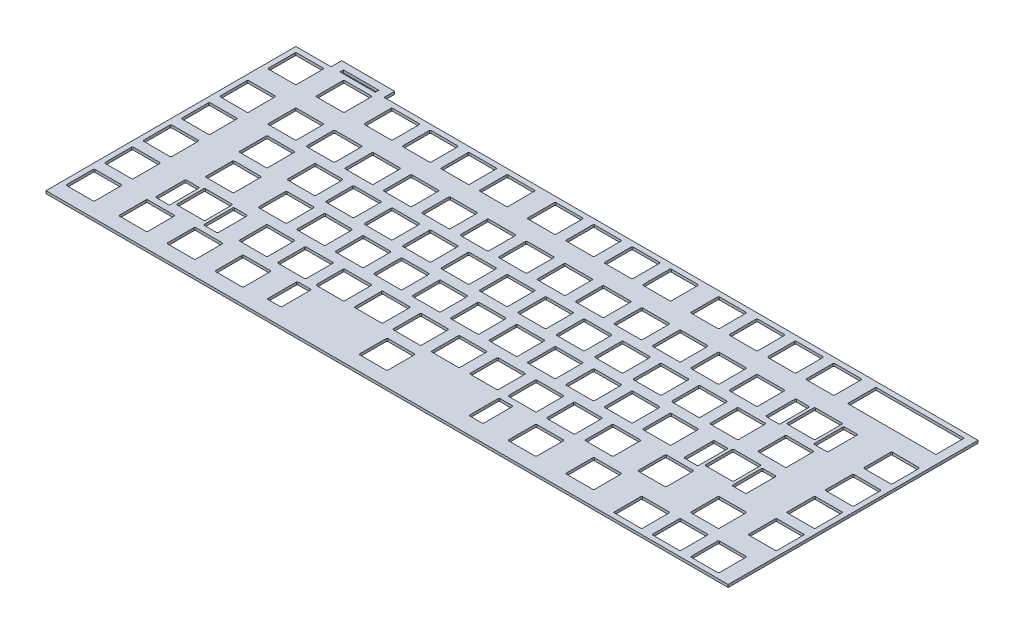
from build123d import *

# Parameters (mm, degrees)
SKETCH5_W           = 50
SKETCH5_H           = 16
SKETCH5_W_2         = 20
SKETCH5_H_2         = 2
BOSS_EXTRUDE1_DEPTH = 1.5


with BuildPart() as part:
    # Sketch5 → Boss-Extrude1 (new body)
    with BuildSketch(Plane(origin=(0, 0, 0), x_dir=(1, 0, 0), z_dir=(0, 1, 0))):
        Polygon((0, -141.514285714), (386.442857143, -141.514285714), (386.442857143, 0), (50, 0), (50, 6), (20, 6), (20, 0), (0, 0), align=None)
        with BuildLine():
            Line((3.457142857, -2.885714286), (18.314285714, -2.885714286))
            ThreePointArc((18.314285714, -2.885714286), (18.718346732, -3.053081839), (18.885714286, -3.457142857))
            Line((18.885714286, -3.457142857), (18.885714286, -18.314285714))
            ThreePointArc((18.885714286, -18.314285714), (18.718346732, -18.718346732), (18.314285714, -18.885714286))
            Line((18.314285714, -18.885714286), (3.457142857, -18.885714286))
            ThreePointArc((3.457142857, -18.885714286), (3.053081839, -18.718346732), (2.885714286, -18.314285714))
            Line((2.885714286, -18.314285714), (2.885714286, -3.457142857))
            ThreePointArc((2.885714286, -3.457142857), (3.053081839, -3.053081839), (3.457142857, -2.885714286))
        make_face(mode=Mode.SUBTRACT)
        with BuildLine():
            Line((30.671428571, -2.885714286), (45.528571429, -2.885714286))
            ThreePointArc((45.528571429, -2.885714286), (45.932632446, -3.053081839), (46.1, -3.457142857))
            Line((46.1, -3.457142857), (46.1, -18.314285714))
            ThreePointArc((46.1, -18.314285714), (45.932632446, -18.718346732), (45.528571429, -18.885714286))
            Line((45.528571429, -18.885714286), (30.671428571, -18.885714286))
            ThreePointArc((30.671428571, -18.885714286), (30.267367554, -18.718346732), (30.1, -18.314285714))
            Line((30.1, -18.314285714), (30.1, -3.457142857))
            ThreePointArc((30.1, -3.457142857), (30.267367554, -3.053081839), (30.671428571, -2.885714286))
        make_face(mode=Mode.SUBTRACT)
        with BuildLine():
            Line((57.885714286, -2.885714286), (72.742857143, -2.885714286))
            ThreePointArc((72.742857143, -2.885714286), (73.146918161, -3.053081839), (73.314285714, -3.457142857))
            Line((73.314285714, -3.457142857), (73.314285714, -18.314285714))
            ThreePointArc((73.314285714, -18.314285714), (73.146918161, -18.718346732), (72.742857143, -18.885714286))
            Line((72.742857143, -18.885714286), (57.885714286, -18.885714286))
            ThreePointArc((57.885714286, -18.885714286), (57.481653268, -18.718346732), (57.314285714, -18.314285714))
            Line((57.314285714, -18.314285714), (57.314285714, -3.457142857))
            ThreePointArc((57.314285714, -3.457142857), (57.481653268, -3.053081839), (57.885714286, -2.885714286))
        make_face(mode=Mode.SUBTRACT)
        with BuildLine():
            Line((79.657142857, -2.885714286), (94.514285714, -2.885714286))
            ThreePointArc((94.514285714, -2.885714286), (94.918346732, -3.053081839), (95.085714286, -3.457142857))
            Line((95.085714286, -3.457142857), (95.085714286, -18.314285714))
            ThreePointArc((95.085714286, -18.314285714), (94.918346732, -18.718346732), (94.514285714, -18.885714286))
            Line((94.514285714, -18.885714286), (79.657142857, -18.885714286))
            ThreePointArc((79.657142857, -18.885714286), (79.253081839, -18.718346732), (79.085714286, -18.314285714))
            Line((79.085714286, -18.314285714), (79.085714286, -3.457142857))
            ThreePointArc((79.085714286, -3.457142857), (79.253081839, -3.053081839), (79.657142857, -2.885714286))
        make_face(mode=Mode.SUBTRACT)
        with BuildLine():
            Line((101.428571429, -2.885714286), (116.285714286, -2.885714286))
            ThreePointArc((116.285714286, -2.885714286), (116.689775304, -3.053081839), (116.857142857, -3.457142857))
            Line((116.857142857, -3.457142857), (116.857142857, -18.314285714))
            ThreePointArc((116.857142857, -18.314285714), (116.689775304, -18.718346732), (116.285714286, -18.885714286))
            Line((116.285714286, -18.885714286), (101.428571429, -18.885714286))
            ThreePointArc((101.428571429, -18.885714286), (101.024510411, -18.718346732), (100.857142857, -18.314285714))
            Line((100.857142857, -18.314285714), (100.857142857, -3.457142857))
            ThreePointArc((100.857142857, -3.457142857), (101.024510411, -3.053081839), (101.428571429, -2.885714286))
        make_face(mode=Mode.SUBTRACT)
        with BuildLine():
            Line((123.2, -2.885714286), (138.057142857, -2.885714286))
            ThreePointArc((138.057142857, -2.885714286), (138.461203875, -3.053081839), (138.628571429, -3.457142857))
            Line((138.628571429, -3.457142857), (138.628571429, -18.314285714))
            ThreePointArc((138.628571429, -18.314285714), (138.461203875, -18.718346732), (138.057142857, -18.885714286))
            Line((138.057142857, -18.885714286), (123.2, -18.885714286))
            ThreePointArc((123.2, -18.885714286), (122.795938982, -18.718346732), (122.628571429, -18.314285714))
            Line((122.628571429, -18.314285714), (122.628571429, -3.457142857))
            ThreePointArc((122.628571429, -3.457142857), (122.795938982, -3.053081839), (123.2, -2.885714286))
        make_face(mode=Mode.SUBTRACT)
        with BuildLine():
            Line((150.414285714, -2.885714286), (165.271428571, -2.885714286))
            ThreePointArc((165.271428571, -2.885714286), (165.675489589, -3.053081839), (165.842857143, -3.457142857))
            Line((165.842857143, -3.457142857), (165.842857143, -18.314285714))
            ThreePointArc((165.842857143, -18.314285714), (165.675489589, -18.718346732), (165.271428571, -18.885714286))
            Line((165.271428571, -18.885714286), (150.414285714, -18.885714286))
            ThreePointArc((150.414285714, -18.885714286), (150.010224696, -18.718346732), (149.842857143, -18.314285714))
            Line((149.842857143, -18.314285714), (149.842857143, -3.457142857))
            ThreePointArc((149.842857143, -3.457142857), (150.010224696, -3.053081839), (150.414285714, -2.885714286))
        make_face(mode=Mode.SUBTRACT)
        with BuildLine():
            Line((172.185714286, -2.885714286), (187.042857143, -2.885714286))
            ThreePointArc((187.042857143, -2.885714286), (187.446918161, -3.053081839), (187.614285714, -3.457142857))
            Line((187.614285714, -3.457142857), (187.614285714, -18.314285714))
            ThreePointArc((187.614285714, -18.314285714), (187.446918161, -18.718346732), (187.042857143, -18.885714286))
            Line((187.042857143, -18.885714286), (172.185714286, -18.885714286))
            ThreePointArc((172.185714286, -18.885714286), (171.781653268, -18.718346732), (171.614285714, -18.314285714))
            Line((171.614285714, -18.314285714), (171.614285714, -3.457142857))
            ThreePointArc((171.614285714, -3.457142857), (171.781653268, -3.053081839), (172.185714286, -2.885714286))
        make_face(mode=Mode.SUBTRACT)
        with BuildLine():
            Line((193.957142857, -2.885714286), (208.814285714, -2.885714286))
            ThreePointArc((208.814285714, -2.885714286), (209.218346732, -3.053081839), (209.385714286, -3.457142857))
            Line((209.385714286, -3.457142857), (209.385714286, -18.314285714))
            ThreePointArc((209.385714286, -18.314285714), (209.218346732, -18.718346732), (208.814285714, -18.885714286))
            Line((208.814285714, -18.885714286), (193.957142857, -18.885714286))
            ThreePointArc((193.957142857, -18.885714286), (193.553081839, -18.718346732), (193.385714286, -18.314285714))
            Line((193.385714286, -18.314285714), (193.385714286, -3.457142857))
            ThreePointArc((193.385714286, -3.457142857), (193.553081839, -3.053081839), (193.957142857, -2.885714286))
        make_face(mode=Mode.SUBTRACT)
        with BuildLine():
            Line((215.728571429, -2.885714286), (230.585714286, -2.885714286))
            ThreePointArc((230.585714286, -2.885714286), (230.989775304, -3.053081839), (231.157142857, -3.457142857))
            Line((231.157142857, -3.457142857), (231.157142857, -18.314285714))
            ThreePointArc((231.157142857, -18.314285714), (230.989775304, -18.718346732), (230.585714286, -18.885714286))
            Line((230.585714286, -18.885714286), (215.728571429, -18.885714286))
            ThreePointArc((215.728571429, -18.885714286), (215.324510411, -18.718346732), (215.157142857, -18.314285714))
            Line((215.157142857, -18.314285714), (215.157142857, -3.457142857))
            ThreePointArc((215.157142857, -3.457142857), (215.324510411, -3.053081839), (215.728571429, -2.885714286))
        make_face(mode=Mode.SUBTRACT)
        with BuildLine():
            Line((242.942857143, -2.885714286), (257.8, -2.885714286))
            ThreePointArc((257.8, -2.885714286), (258.204061018, -3.053081839), (258.371428571, -3.457142857))
            Line((258.371428571, -3.457142857), (258.371428571, -18.314285714))
            ThreePointArc((258.371428571, -18.314285714), (258.204061018, -18.718346732), (257.8, -18.885714286))
            Line((257.8, -18.885714286), (242.942857143, -18.885714286))
            ThreePointArc((242.942857143, -18.885714286), (242.538796125, -18.718346732), (242.371428571, -18.314285714))
            Line((242.371428571, -18.314285714), (242.371428571, -3.457142857))
            ThreePointArc((242.371428571, -3.457142857), (242.538796125, -3.053081839), (242.942857143, -2.885714286))
        make_face(mode=Mode.SUBTRACT)
        with BuildLine():
            Line((264.714285714, -2.885714286), (279.571428571, -2.885714286))
            ThreePointArc((279.571428571, -2.885714286), (279.975489589, -3.053081839), (280.142857143, -3.457142857))
            Line((280.142857143, -3.457142857), (280.142857143, -18.314285714))
            ThreePointArc((280.142857143, -18.314285714), (279.975489589, -18.718346732), (279.571428571, -18.885714286))
            Line((279.571428571, -18.885714286), (264.714285714, -18.885714286))
            ThreePointArc((264.714285714, -18.885714286), (264.310224696, -18.718346732), (264.142857143, -18.314285714))
            Line((264.142857143, -18.314285714), (264.142857143, -3.457142857))
            ThreePointArc((264.142857143, -3.457142857), (264.310224696, -3.053081839), (264.714285714, -2.885714286))
        make_face(mode=Mode.SUBTRACT)
        with BuildLine():
            Line((286.485714286, -2.885714286), (301.342857143, -2.885714286))
            ThreePointArc((301.342857143, -2.885714286), (301.746918161, -3.053081839), (301.914285714, -3.457142857))
            Line((301.914285714, -3.457142857), (301.914285714, -18.314285714))
            ThreePointArc((301.914285714, -18.314285714), (301.746918161, -18.718346732), (301.342857143, -18.885714286))
            Line((301.342857143, -18.885714286), (286.485714286, -18.885714286))
            ThreePointArc((286.485714286, -18.885714286), (286.081653268, -18.718346732), (285.914285714, -18.314285714))
            Line((285.914285714, -18.314285714), (285.914285714, -3.457142857))
            ThreePointArc((285.914285714, -3.457142857), (286.081653268, -3.053081839), (286.485714286, -2.885714286))
        make_face(mode=Mode.SUBTRACT)
        with BuildLine():
            Line((308.257142857, -2.885714286), (323.114285714, -2.885714286))
            ThreePointArc((323.114285714, -2.885714286), (323.518346732, -3.053081839), (323.685714286, -3.457142857))
            Line((323.685714286, -3.457142857), (323.685714286, -18.314285714))
            ThreePointArc((323.685714286, -18.314285714), (323.518346732, -18.718346732), (323.114285714, -18.885714286))
            Line((323.114285714, -18.885714286), (308.257142857, -18.885714286))
            ThreePointArc((308.257142857, -18.885714286), (307.853081839, -18.718346732), (307.685714286, -18.314285714))
            Line((307.685714286, -18.314285714), (307.685714286, -3.457142857))
            ThreePointArc((307.685714286, -3.457142857), (307.853081839, -3.053081839), (308.257142857, -2.885714286))
        make_face(mode=Mode.SUBTRACT)
        with Locations((356.483098489, -10.885714286)):
            Rectangle(SKETCH5_W, SKETCH5_H, mode=Mode.SUBTRACT)
        with BuildLine():
            Line((3.457142857, -30.1), (18.314285714, -30.1))
            ThreePointArc((18.314285714, -30.1), (18.718346732, -30.267367554), (18.885714286, -30.671428571))
            Line((18.885714286, -30.671428571), (18.885714286, -45.528571429))
            ThreePointArc((18.885714286, -45.528571429), (18.718346732, -45.932632446), (18.314285714, -46.1))
            Line((18.314285714, -46.1), (3.457142857, -46.1))
            ThreePointArc((3.457142857, -46.1), (3.053081839, -45.932632446), (2.885714286, -45.528571429))
            Line((2.885714286, -45.528571429), (2.885714286, -30.671428571))
            ThreePointArc((2.885714286, -30.671428571), (3.053081839, -30.267367554), (3.457142857, -30.1))
        make_face(mode=Mode.SUBTRACT)
        with BuildLine():
            Line((30.671428571, -30.1), (45.528571429, -30.1))
            ThreePointArc((45.528571429, -30.1), (45.932632446, -30.267367554), (46.1, -30.671428571))
            Line((46.1, -30.671428571), (46.1, -45.528571429))
            ThreePointArc((46.1, -45.528571429), (45.932632446, -45.932632446), (45.528571429, -46.1))
            Line((45.528571429, -46.1), (30.671428571, -46.1))
            ThreePointArc((30.671428571, -46.1), (30.267367554, -45.932632446), (30.1, -45.528571429))
            Line((30.1, -45.528571429), (30.1, -30.671428571))
            ThreePointArc((30.1, -30.671428571), (30.267367554, -30.267367554), (30.671428571, -30.1))
        make_face(mode=Mode.SUBTRACT)
        with BuildLine():
            Line((52.442857143, -30.1), (67.3, -30.1))
            ThreePointArc((67.3, -30.1), (67.704061018, -30.267367554), (67.871428571, -30.671428571))
            Line((67.871428571, -30.671428571), (67.871428571, -45.528571429))
            ThreePointArc((67.871428571, -45.528571429), (67.704061018, -45.932632446), (67.3, -46.1))
            Line((67.3, -46.1), (52.442857143, -46.1))
            ThreePointArc((52.442857143, -46.1), (52.038796125, -45.932632446), (51.871428571, -45.528571429))
            Line((51.871428571, -45.528571429), (51.871428571, -30.671428571))
            ThreePointArc((51.871428571, -30.671428571), (52.038796125, -30.267367554), (52.442857143, -30.1))
        make_face(mode=Mode.SUBTRACT)
        with BuildLine():
            Line((74.214285714, -30.1), (89.071428571, -30.1))
            ThreePointArc((89.071428571, -30.1), (89.475489589, -30.267367554), (89.642857143, -30.671428571))
            Line((89.642857143, -30.671428571), (89.642857143, -45.528571429))
            ThreePointArc((89.642857143, -45.528571429), (89.475489589, -45.932632446), (89.071428571, -46.1))
            Line((89.071428571, -46.1), (74.214285714, -46.1))
            ThreePointArc((74.214285714, -46.1), (73.810224696, -45.932632446), (73.642857143, -45.528571429))
            Line((73.642857143, -45.528571429), (73.642857143, -30.671428571))
            ThreePointArc((73.642857143, -30.671428571), (73.810224696, -30.267367554), (74.214285714, -30.1))
        make_face(mode=Mode.SUBTRACT)
        with BuildLine():
            Line((95.985714286, -30.1), (110.842857143, -30.1))
            ThreePointArc((110.842857143, -30.1), (111.246918161, -30.267367554), (111.414285714, -30.671428571))
            Line((111.414285714, -30.671428571), (111.414285714, -45.528571429))
            ThreePointArc((111.414285714, -45.528571429), (111.246918161, -45.932632446), (110.842857143, -46.1))
            Line((110.842857143, -46.1), (95.985714286, -46.1))
            ThreePointArc((95.985714286, -46.1), (95.581653268, -45.932632446), (95.414285714, -45.528571429))
            Line((95.414285714, -45.528571429), (95.414285714, -30.671428571))
            ThreePointArc((95.414285714, -30.671428571), (95.581653268, -30.267367554), (95.985714286, -30.1))
        make_face(mode=Mode.SUBTRACT)
        with BuildLine():
            Line((117.757142857, -30.1), (132.614285714, -30.1))
            ThreePointArc((132.614285714, -30.1), (133.018346732, -30.267367554), (133.185714286, -30.671428571))
            Line((133.185714286, -30.671428571), (133.185714286, -45.528571429))
            ThreePointArc((133.185714286, -45.528571429), (133.018346732, -45.932632446), (132.614285714, -46.1))
            Line((132.614285714, -46.1), (117.757142857, -46.1))
            ThreePointArc((117.757142857, -46.1), (117.353081839, -45.932632446), (117.185714286, -45.528571429))
            Line((117.185714286, -45.528571429), (117.185714286, -30.671428571))
            ThreePointArc((117.185714286, -30.671428571), (117.353081839, -30.267367554), (117.757142857, -30.1))
        make_face(mode=Mode.SUBTRACT)
        with BuildLine():
            Line((139.528571429, -30.1), (154.385714286, -30.1))
            ThreePointArc((154.385714286, -30.1), (154.789775304, -30.267367554), (154.957142857, -30.671428571))
            Line((154.957142857, -30.671428571), (154.957142857, -45.528571429))
            ThreePointArc((154.957142857, -45.528571429), (154.789775304, -45.932632446), (154.385714286, -46.1))
            Line((154.385714286, -46.1), (139.528571429, -46.1))
            ThreePointArc((139.528571429, -46.1), (139.124510411, -45.932632446), (138.957142857, -45.528571429))
            Line((138.957142857, -45.528571429), (138.957142857, -30.671428571))
            ThreePointArc((138.957142857, -30.671428571), (139.124510411, -30.267367554), (139.528571429, -30.1))
        make_face(mode=Mode.SUBTRACT)
        with BuildLine():
            Line((161.3, -30.1), (176.157142857, -30.1))
            ThreePointArc((176.157142857, -30.1), (176.561203875, -30.267367554), (176.728571429, -30.671428571))
            Line((176.728571429, -30.671428571), (176.728571429, -45.528571429))
            ThreePointArc((176.728571429, -45.528571429), (176.561203875, -45.932632446), (176.157142857, -46.1))
            Line((176.157142857, -46.1), (161.3, -46.1))
            ThreePointArc((161.3, -46.1), (160.895938982, -45.932632446), (160.728571429, -45.528571429))
            Line((160.728571429, -45.528571429), (160.728571429, -30.671428571))
            ThreePointArc((160.728571429, -30.671428571), (160.895938982, -30.267367554), (161.3, -30.1))
        make_face(mode=Mode.SUBTRACT)
        with BuildLine():
            Line((183.071428571, -30.1), (197.928571429, -30.1))
            ThreePointArc((197.928571429, -30.1), (198.332632446, -30.267367554), (198.5, -30.671428571))
            Line((198.5, -30.671428571), (198.5, -45.528571429))
            ThreePointArc((198.5, -45.528571429), (198.332632446, -45.932632446), (197.928571429, -46.1))
            Line((197.928571429, -46.1), (183.071428571, -46.1))
            ThreePointArc((183.071428571, -46.1), (182.667367554, -45.932632446), (182.5, -45.528571429))
            Line((182.5, -45.528571429), (182.5, -30.671428571))
            ThreePointArc((182.5, -30.671428571), (182.667367554, -30.267367554), (183.071428571, -30.1))
        make_face(mode=Mode.SUBTRACT)
        with BuildLine():
            Line((204.842857143, -30.1), (219.7, -30.1))
            ThreePointArc((219.7, -30.1), (220.104061018, -30.267367554), (220.271428571, -30.671428571))
            Line((220.271428571, -30.671428571), (220.271428571, -45.528571429))
            ThreePointArc((220.271428571, -45.528571429), (220.104061018, -45.932632446), (219.7, -46.1))
            Line((219.7, -46.1), (204.842857143, -46.1))
            ThreePointArc((204.842857143, -46.1), (204.438796125, -45.932632446), (204.271428571, -45.528571429))
            Line((204.271428571, -45.528571429), (204.271428571, -30.671428571))
            ThreePointArc((204.271428571, -30.671428571), (204.438796125, -30.267367554), (204.842857143, -30.1))
        make_face(mode=Mode.SUBTRACT)
        with BuildLine():
            Line((226.614285714, -30.1), (241.471428571, -30.1))
            ThreePointArc((241.471428571, -30.1), (241.875489589, -30.267367554), (242.042857143, -30.671428571))
            Line((242.042857143, -30.671428571), (242.042857143, -45.528571429))
            ThreePointArc((242.042857143, -45.528571429), (241.875489589, -45.932632446), (241.471428571, -46.1))
            Line((241.471428571, -46.1), (226.614285714, -46.1))
            ThreePointArc((226.614285714, -46.1), (226.210224696, -45.932632446), (226.042857143, -45.528571429))
            Line((226.042857143, -45.528571429), (226.042857143, -30.671428571))
            ThreePointArc((226.042857143, -30.671428571), (226.210224696, -30.267367554), (226.614285714, -30.1))
        make_face(mode=Mode.SUBTRACT)
        with BuildLine():
            Line((248.385714286, -30.1), (263.242857143, -30.1))
            ThreePointArc((263.242857143, -30.1), (263.646918161, -30.267367554), (263.814285714, -30.671428571))
            Line((263.814285714, -30.671428571), (263.814285714, -45.528571429))
            ThreePointArc((263.814285714, -45.528571429), (263.646918161, -45.932632446), (263.242857143, -46.1))
            Line((263.242857143, -46.1), (248.385714286, -46.1))
            ThreePointArc((248.385714286, -46.1), (247.981653268, -45.932632446), (247.814285714, -45.528571429))
            Line((247.814285714, -45.528571429), (247.814285714, -30.671428571))
            ThreePointArc((247.814285714, -30.671428571), (247.981653268, -30.267367554), (248.385714286, -30.1))
        make_face(mode=Mode.SUBTRACT)
        with BuildLine():
            Line((270.157142857, -30.1), (285.014285714, -30.1))
            ThreePointArc((285.014285714, -30.1), (285.418346732, -30.267367554), (285.585714286, -30.671428571))
            Line((285.585714286, -30.671428571), (285.585714286, -45.528571429))
            ThreePointArc((285.585714286, -45.528571429), (285.418346732, -45.932632446), (285.014285714, -46.1))
            Line((285.014285714, -46.1), (270.157142857, -46.1))
            ThreePointArc((270.157142857, -46.1), (269.753081839, -45.932632446), (269.585714286, -45.528571429))
            Line((269.585714286, -45.528571429), (269.585714286, -30.671428571))
            ThreePointArc((269.585714286, -30.671428571), (269.753081839, -30.267367554), (270.157142857, -30.1))
        make_face(mode=Mode.SUBTRACT)
        with BuildLine():
            Line((291.928571429, -30.1), (306.785714286, -30.1))
            ThreePointArc((306.785714286, -30.1), (307.189775304, -30.267367554), (307.357142857, -30.671428571))
            Line((307.357142857, -30.671428571), (307.357142857, -45.528571429))
            ThreePointArc((307.357142857, -45.528571429), (307.189775304, -45.932632446), (306.785714286, -46.1))
            Line((306.785714286, -46.1), (291.928571429, -46.1))
            ThreePointArc((291.928571429, -46.1), (291.524510411, -45.932632446), (291.357142857, -45.528571429))
            Line((291.357142857, -45.528571429), (291.357142857, -30.671428571))
            ThreePointArc((291.357142857, -30.671428571), (291.524510411, -30.267367554), (291.928571429, -30.1))
        make_face(mode=Mode.SUBTRACT)
        with BuildLine():
            Line((324.585714286, -30.1), (339.442857143, -30.1))
            ThreePointArc((339.442857143, -30.1), (339.846918161, -30.267367554), (340.014285714, -30.671428571))
            Line((340.014285714, -30.671428571), (340.014285714, -45.528571429))
            ThreePointArc((340.014285714, -45.528571429), (339.846918161, -45.932632446), (339.442857143, -46.1))
            Line((339.442857143, -46.1), (324.585714286, -46.1))
            ThreePointArc((324.585714286, -46.1), (324.181653268, -45.932632446), (324.014285714, -45.528571429))
            Line((324.014285714, -45.528571429), (324.014285714, -30.671428571))
            ThreePointArc((324.014285714, -30.671428571), (324.181653268, -30.267367554), (324.585714286, -30.1))
        make_face(mode=Mode.SUBTRACT)
        with BuildLine():
            Line((314.942285714, -31.242857143), (321.799428571, -31.242857143))
            ThreePointArc((321.799428571, -31.242857143), (322.203489589, -31.410224696), (322.370857143, -31.814285714))
            Line((322.370857143, -31.814285714), (322.370857143, -47.814285714))
            ThreePointArc((322.370857143, -47.814285714), (322.203489589, -48.218346732), (321.799428571, -48.385714286))
            Line((321.799428571, -48.385714286), (314.942285714, -48.385714286))
            ThreePointArc((314.942285714, -48.385714286), (314.538224696, -48.218346732), (314.370857143, -47.814285714))
            Line((314.370857143, -47.814285714), (314.370857143, -31.814285714))
            ThreePointArc((314.370857143, -31.814285714), (314.538224696, -31.410224696), (314.942285714, -31.242857143))
        make_face(mode=Mode.SUBTRACT)
        with BuildLine():
            Line((342.229142857, -31.242857143), (349.086285714, -31.242857143))
            ThreePointArc((349.086285714, -31.242857143), (349.490346732, -31.410224696), (349.657714286, -31.814285714))
            Line((349.657714286, -31.814285714), (349.657714286, -47.814285714))
            ThreePointArc((349.657714286, -47.814285714), (349.490346732, -48.218346732), (349.086285714, -48.385714286))
            Line((349.086285714, -48.385714286), (342.229142857, -48.385714286))
            ThreePointArc((342.229142857, -48.385714286), (341.825081839, -48.218346732), (341.657714286, -47.814285714))
            Line((341.657714286, -47.814285714), (341.657714286, -31.814285714))
            ThreePointArc((341.657714286, -31.814285714), (341.825081839, -31.410224696), (342.229142857, -31.242857143))
        make_face(mode=Mode.SUBTRACT)
        with BuildLine():
            Line((368.128571429, -30.1), (382.985714286, -30.1))
            ThreePointArc((382.985714286, -30.1), (383.389775304, -30.267367554), (383.557142857, -30.671428571))
            Line((383.557142857, -30.671428571), (383.557142857, -45.528571429))
            ThreePointArc((383.557142857, -45.528571429), (383.389775304, -45.932632446), (382.985714286, -46.1))
            Line((382.985714286, -46.1), (368.128571429, -46.1))
            ThreePointArc((368.128571429, -46.1), (367.724510411, -45.932632446), (367.557142857, -45.528571429))
            Line((367.557142857, -45.528571429), (367.557142857, -30.671428571))
            ThreePointArc((367.557142857, -30.671428571), (367.724510411, -30.267367554), (368.128571429, -30.1))
        make_face(mode=Mode.SUBTRACT)
        with BuildLine():
            Line((3.457142857, -51.871428571), (18.314285714, -51.871428571))
            ThreePointArc((18.314285714, -51.871428571), (18.718346732, -52.038796125), (18.885714286, -52.442857143))
            Line((18.885714286, -52.442857143), (18.885714286, -67.3))
            ThreePointArc((18.885714286, -67.3), (18.718346732, -67.704061018), (18.314285714, -67.871428571))
            Line((18.314285714, -67.871428571), (3.457142857, -67.871428571))
            ThreePointArc((3.457142857, -67.871428571), (3.053081839, -67.704061018), (2.885714286, -67.3))
            Line((2.885714286, -67.3), (2.885714286, -52.442857143))
            ThreePointArc((2.885714286, -52.442857143), (3.053081839, -52.038796125), (3.457142857, -51.871428571))
        make_face(mode=Mode.SUBTRACT)
        with BuildLine():
            Line((36.114285714, -51.871428571), (50.971428571, -51.871428571))
            ThreePointArc((50.971428571, -51.871428571), (51.375489589, -52.038796125), (51.542857143, -52.442857143))
            Line((51.542857143, -52.442857143), (51.542857143, -67.3))
            ThreePointArc((51.542857143, -67.3), (51.375489589, -67.704061018), (50.971428571, -67.871428571))
            Line((50.971428571, -67.871428571), (36.114285714, -67.871428571))
            ThreePointArc((36.114285714, -67.871428571), (35.710224696, -67.704061018), (35.542857143, -67.3))
            Line((35.542857143, -67.3), (35.542857143, -52.442857143))
            ThreePointArc((35.542857143, -52.442857143), (35.710224696, -52.038796125), (36.114285714, -51.871428571))
        make_face(mode=Mode.SUBTRACT)
        with BuildLine():
            Line((63.328571429, -51.871428571), (78.185714286, -51.871428571))
            ThreePointArc((78.185714286, -51.871428571), (78.589775304, -52.038796125), (78.757142857, -52.442857143))
            Line((78.757142857, -52.442857143), (78.757142857, -67.3))
            ThreePointArc((78.757142857, -67.3), (78.589775304, -67.704061018), (78.185714286, -67.871428571))
            Line((78.185714286, -67.871428571), (63.328571429, -67.871428571))
            ThreePointArc((63.328571429, -67.871428571), (62.924510411, -67.704061018), (62.757142857, -67.3))
            Line((62.757142857, -67.3), (62.757142857, -52.442857143))
            ThreePointArc((62.757142857, -52.442857143), (62.924510411, -52.038796125), (63.328571429, -51.871428571))
        make_face(mode=Mode.SUBTRACT)
        with BuildLine():
            Line((85.1, -51.871428571), (99.957142857, -51.871428571))
            ThreePointArc((99.957142857, -51.871428571), (100.361203875, -52.038796125), (100.528571429, -52.442857143))
            Line((100.528571429, -52.442857143), (100.528571429, -67.3))
            ThreePointArc((100.528571429, -67.3), (100.361203875, -67.704061018), (99.957142857, -67.871428571))
            Line((99.957142857, -67.871428571), (85.1, -67.871428571))
            ThreePointArc((85.1, -67.871428571), (84.695938982, -67.704061018), (84.528571429, -67.3))
            Line((84.528571429, -67.3), (84.528571429, -52.442857143))
            ThreePointArc((84.528571429, -52.442857143), (84.695938982, -52.038796125), (85.1, -51.871428571))
        make_face(mode=Mode.SUBTRACT)
        with BuildLine():
            Line((106.871428571, -51.871428571), (121.728571429, -51.871428571))
            ThreePointArc((121.728571429, -51.871428571), (122.132632446, -52.038796125), (122.3, -52.442857143))
            Line((122.3, -52.442857143), (122.3, -67.3))
            ThreePointArc((122.3, -67.3), (122.132632446, -67.704061018), (121.728571429, -67.871428571))
            Line((121.728571429, -67.871428571), (106.871428571, -67.871428571))
            ThreePointArc((106.871428571, -67.871428571), (106.467367554, -67.704061018), (106.3, -67.3))
            Line((106.3, -67.3), (106.3, -52.442857143))
            ThreePointArc((106.3, -52.442857143), (106.467367554, -52.038796125), (106.871428571, -51.871428571))
        make_face(mode=Mode.SUBTRACT)
        with BuildLine():
            Line((128.642857143, -51.871428571), (143.5, -51.871428571))
            ThreePointArc((143.5, -51.871428571), (143.904061018, -52.038796125), (144.071428571, -52.442857143))
            Line((144.071428571, -52.442857143), (144.071428571, -67.3))
            ThreePointArc((144.071428571, -67.3), (143.904061018, -67.704061018), (143.5, -67.871428571))
            Line((143.5, -67.871428571), (128.642857143, -67.871428571))
            ThreePointArc((128.642857143, -67.871428571), (128.238796125, -67.704061018), (128.071428571, -67.3))
            Line((128.071428571, -67.3), (128.071428571, -52.442857143))
            ThreePointArc((128.071428571, -52.442857143), (128.238796125, -52.038796125), (128.642857143, -51.871428571))
        make_face(mode=Mode.SUBTRACT)
        with BuildLine():
            Line((150.414285714, -51.871428571), (165.271428571, -51.871428571))
            ThreePointArc((165.271428571, -51.871428571), (165.675489589, -52.038796125), (165.842857143, -52.442857143))
            Line((165.842857143, -52.442857143), (165.842857143, -67.3))
            ThreePointArc((165.842857143, -67.3), (165.675489589, -67.704061018), (165.271428571, -67.871428571))
            Line((165.271428571, -67.871428571), (150.414285714, -67.871428571))
            ThreePointArc((150.414285714, -67.871428571), (150.010224696, -67.704061018), (149.842857143, -67.3))
            Line((149.842857143, -67.3), (149.842857143, -52.442857143))
            ThreePointArc((149.842857143, -52.442857143), (150.010224696, -52.038796125), (150.414285714, -51.871428571))
        make_face(mode=Mode.SUBTRACT)
        with BuildLine():
            Line((172.185714286, -51.871428571), (187.042857143, -51.871428571))
            ThreePointArc((187.042857143, -51.871428571), (187.446918161, -52.038796125), (187.614285714, -52.442857143))
            Line((187.614285714, -52.442857143), (187.614285714, -67.3))
            ThreePointArc((187.614285714, -67.3), (187.446918161, -67.704061018), (187.042857143, -67.871428571))
            Line((187.042857143, -67.871428571), (172.185714286, -67.871428571))
            ThreePointArc((172.185714286, -67.871428571), (171.781653268, -67.704061018), (171.614285714, -67.3))
            Line((171.614285714, -67.3), (171.614285714, -52.442857143))
            ThreePointArc((171.614285714, -52.442857143), (171.781653268, -52.038796125), (172.185714286, -51.871428571))
        make_face(mode=Mode.SUBTRACT)
        with BuildLine():
            Line((193.957142857, -51.871428571), (208.814285714, -51.871428571))
            ThreePointArc((208.814285714, -51.871428571), (209.218346732, -52.038796125), (209.385714286, -52.442857143))
            Line((209.385714286, -52.442857143), (209.385714286, -67.3))
            ThreePointArc((209.385714286, -67.3), (209.218346732, -67.704061018), (208.814285714, -67.871428571))
            Line((208.814285714, -67.871428571), (193.957142857, -67.871428571))
            ThreePointArc((193.957142857, -67.871428571), (193.553081839, -67.704061018), (193.385714286, -67.3))
            Line((193.385714286, -67.3), (193.385714286, -52.442857143))
            ThreePointArc((193.385714286, -52.442857143), (193.553081839, -52.038796125), (193.957142857, -51.871428571))
        make_face(mode=Mode.SUBTRACT)
        with BuildLine():
            Line((215.728571429, -51.871428571), (230.585714286, -51.871428571))
            ThreePointArc((230.585714286, -51.871428571), (230.989775304, -52.038796125), (231.157142857, -52.442857143))
            Line((231.157142857, -52.442857143), (231.157142857, -67.3))
            ThreePointArc((231.157142857, -67.3), (230.989775304, -67.704061018), (230.585714286, -67.871428571))
            Line((230.585714286, -67.871428571), (215.728571429, -67.871428571))
            ThreePointArc((215.728571429, -67.871428571), (215.324510411, -67.704061018), (215.157142857, -67.3))
            Line((215.157142857, -67.3), (215.157142857, -52.442857143))
            ThreePointArc((215.157142857, -52.442857143), (215.324510411, -52.038796125), (215.728571429, -51.871428571))
        make_face(mode=Mode.SUBTRACT)
        with BuildLine():
            Line((237.5, -51.871428571), (252.357142857, -51.871428571))
            ThreePointArc((252.357142857, -51.871428571), (252.761203875, -52.038796125), (252.928571429, -52.442857143))
            Line((252.928571429, -52.442857143), (252.928571429, -67.3))
            ThreePointArc((252.928571429, -67.3), (252.761203875, -67.704061018), (252.357142857, -67.871428571))
            Line((252.357142857, -67.871428571), (237.5, -67.871428571))
            ThreePointArc((237.5, -67.871428571), (237.095938982, -67.704061018), (236.928571429, -67.3))
            Line((236.928571429, -67.3), (236.928571429, -52.442857143))
            ThreePointArc((236.928571429, -52.442857143), (237.095938982, -52.038796125), (237.5, -51.871428571))
        make_face(mode=Mode.SUBTRACT)
        with BuildLine():
            Line((259.271428571, -51.871428571), (274.128571429, -51.871428571))
            ThreePointArc((274.128571429, -51.871428571), (274.532632446, -52.038796125), (274.7, -52.442857143))
            Line((274.7, -52.442857143), (274.7, -67.3))
            ThreePointArc((274.7, -67.3), (274.532632446, -67.704061018), (274.128571429, -67.871428571))
            Line((274.128571429, -67.871428571), (259.271428571, -67.871428571))
            ThreePointArc((259.271428571, -67.871428571), (258.867367554, -67.704061018), (258.7, -67.3))
            Line((258.7, -67.3), (258.7, -52.442857143))
            ThreePointArc((258.7, -52.442857143), (258.867367554, -52.038796125), (259.271428571, -51.871428571))
        make_face(mode=Mode.SUBTRACT)
        with BuildLine():
            Line((281.042857143, -51.871428571), (295.9, -51.871428571))
            ThreePointArc((295.9, -51.871428571), (296.304061018, -52.038796125), (296.471428571, -52.442857143))
            Line((296.471428571, -52.442857143), (296.471428571, -67.3))
            ThreePointArc((296.471428571, -67.3), (296.304061018, -67.704061018), (295.9, -67.871428571))
            Line((295.9, -67.871428571), (281.042857143, -67.871428571))
            ThreePointArc((281.042857143, -67.871428571), (280.638796125, -67.704061018), (280.471428571, -67.3))
            Line((280.471428571, -67.3), (280.471428571, -52.442857143))
            ThreePointArc((280.471428571, -52.442857143), (280.638796125, -52.038796125), (281.042857143, -51.871428571))
        make_face(mode=Mode.SUBTRACT)
        with BuildLine():
            Line((302.814285714, -51.871428571), (317.671428571, -51.871428571))
            ThreePointArc((317.671428571, -51.871428571), (318.075489589, -52.038796125), (318.242857143, -52.442857143))
            Line((318.242857143, -52.442857143), (318.242857143, -67.3))
            ThreePointArc((318.242857143, -67.3), (318.075489589, -67.704061018), (317.671428571, -67.871428571))
            Line((317.671428571, -67.871428571), (302.814285714, -67.871428571))
            ThreePointArc((302.814285714, -67.871428571), (302.410224696, -67.704061018), (302.242857143, -67.3))
            Line((302.242857143, -67.3), (302.242857143, -52.442857143))
            ThreePointArc((302.242857143, -52.442857143), (302.410224696, -52.038796125), (302.814285714, -51.871428571))
        make_face(mode=Mode.SUBTRACT)
        with BuildLine():
            Line((330.028571429, -51.871428571), (344.885714286, -51.871428571))
            ThreePointArc((344.885714286, -51.871428571), (345.289775304, -52.038796125), (345.457142857, -52.442857143))
            Line((345.457142857, -52.442857143), (345.457142857, -67.3))
            ThreePointArc((345.457142857, -67.3), (345.289775304, -67.704061018), (344.885714286, -67.871428571))
            Line((344.885714286, -67.871428571), (330.028571429, -67.871428571))
            ThreePointArc((330.028571429, -67.871428571), (329.624510411, -67.704061018), (329.457142857, -67.3))
            Line((329.457142857, -67.3), (329.457142857, -52.442857143))
            ThreePointArc((329.457142857, -52.442857143), (329.624510411, -52.038796125), (330.028571429, -51.871428571))
        make_face(mode=Mode.SUBTRACT)
        with BuildLine():
            Line((368.128571429, -51.871428571), (382.985714286, -51.871428571))
            ThreePointArc((382.985714286, -51.871428571), (383.389775304, -52.038796125), (383.557142857, -52.442857143))
            Line((383.557142857, -52.442857143), (383.557142857, -67.3))
            ThreePointArc((383.557142857, -67.3), (383.389775304, -67.704061018), (382.985714286, -67.871428571))
            Line((382.985714286, -67.871428571), (368.128571429, -67.871428571))
            ThreePointArc((368.128571429, -67.871428571), (367.724510411, -67.704061018), (367.557142857, -67.3))
            Line((367.557142857, -67.3), (367.557142857, -52.442857143))
            ThreePointArc((367.557142857, -52.442857143), (367.724510411, -52.038796125), (368.128571429, -51.871428571))
        make_face(mode=Mode.SUBTRACT)
        with BuildLine():
            Line((3.457142857, -73.642857143), (18.314285714, -73.642857143))
            ThreePointArc((18.314285714, -73.642857143), (18.718346732, -73.810224696), (18.885714286, -74.214285714))
            Line((18.885714286, -74.214285714), (18.885714286, -89.071428571))
            ThreePointArc((18.885714286, -89.071428571), (18.718346732, -89.475489589), (18.314285714, -89.642857143))
            Line((18.314285714, -89.642857143), (3.457142857, -89.642857143))
            ThreePointArc((3.457142857, -89.642857143), (3.053081839, -89.475489589), (2.885714286, -89.071428571))
            Line((2.885714286, -89.071428571), (2.885714286, -74.214285714))
            ThreePointArc((2.885714286, -74.214285714), (3.053081839, -73.810224696), (3.457142857, -73.642857143))
        make_face(mode=Mode.SUBTRACT)
        with BuildLine():
            Line((38.835714286, -73.642857143), (53.692857143, -73.642857143))
            ThreePointArc((53.692857143, -73.642857143), (54.096918161, -73.810224696), (54.264285714, -74.214285714))
            Line((54.264285714, -74.214285714), (54.264285714, -89.071428571))
            ThreePointArc((54.264285714, -89.071428571), (54.096918161, -89.475489589), (53.692857143, -89.642857143))
            Line((53.692857143, -89.642857143), (38.835714286, -89.642857143))
            ThreePointArc((38.835714286, -89.642857143), (38.431653268, -89.475489589), (38.264285714, -89.071428571))
            Line((38.264285714, -89.071428571), (38.264285714, -74.214285714))
            ThreePointArc((38.264285714, -74.214285714), (38.431653268, -73.810224696), (38.835714286, -73.642857143))
        make_face(mode=Mode.SUBTRACT)
        with BuildLine():
            Line((68.771428571, -73.642857143), (83.628571429, -73.642857143))
            ThreePointArc((83.628571429, -73.642857143), (84.032632446, -73.810224696), (84.2, -74.214285714))
            Line((84.2, -74.214285714), (84.2, -89.071428571))
            ThreePointArc((84.2, -89.071428571), (84.032632446, -89.475489589), (83.628571429, -89.642857143))
            Line((83.628571429, -89.642857143), (68.771428571, -89.642857143))
            ThreePointArc((68.771428571, -89.642857143), (68.367367554, -89.475489589), (68.2, -89.071428571))
            Line((68.2, -89.071428571), (68.2, -74.214285714))
            ThreePointArc((68.2, -74.214285714), (68.367367554, -73.810224696), (68.771428571, -73.642857143))
        make_face(mode=Mode.SUBTRACT)
        with BuildLine():
            Line((90.542857143, -73.642857143), (105.4, -73.642857143))
            ThreePointArc((105.4, -73.642857143), (105.804061018, -73.810224696), (105.971428571, -74.214285714))
            Line((105.971428571, -74.214285714), (105.971428571, -89.071428571))
            ThreePointArc((105.971428571, -89.071428571), (105.804061018, -89.475489589), (105.4, -89.642857143))
            Line((105.4, -89.642857143), (90.542857143, -89.642857143))
            ThreePointArc((90.542857143, -89.642857143), (90.138796125, -89.475489589), (89.971428571, -89.071428571))
            Line((89.971428571, -89.071428571), (89.971428571, -74.214285714))
            ThreePointArc((89.971428571, -74.214285714), (90.138796125, -73.810224696), (90.542857143, -73.642857143))
        make_face(mode=Mode.SUBTRACT)
        with BuildLine():
            Line((112.314285714, -73.642857143), (127.171428571, -73.642857143))
            ThreePointArc((127.171428571, -73.642857143), (127.575489589, -73.810224696), (127.742857143, -74.214285714))
            Line((127.742857143, -74.214285714), (127.742857143, -89.071428571))
            ThreePointArc((127.742857143, -89.071428571), (127.575489589, -89.475489589), (127.171428571, -89.642857143))
            Line((127.171428571, -89.642857143), (112.314285714, -89.642857143))
            ThreePointArc((112.314285714, -89.642857143), (111.910224696, -89.475489589), (111.742857143, -89.071428571))
            Line((111.742857143, -89.071428571), (111.742857143, -74.214285714))
            ThreePointArc((111.742857143, -74.214285714), (111.910224696, -73.810224696), (112.314285714, -73.642857143))
        make_face(mode=Mode.SUBTRACT)
        with BuildLine():
            Line((134.085714286, -73.642857143), (148.942857143, -73.642857143))
            ThreePointArc((148.942857143, -73.642857143), (149.346918161, -73.810224696), (149.514285714, -74.214285714))
            Line((149.514285714, -74.214285714), (149.514285714, -89.071428571))
            ThreePointArc((149.514285714, -89.071428571), (149.346918161, -89.475489589), (148.942857143, -89.642857143))
            Line((148.942857143, -89.642857143), (134.085714286, -89.642857143))
            ThreePointArc((134.085714286, -89.642857143), (133.681653268, -89.475489589), (133.514285714, -89.071428571))
            Line((133.514285714, -89.071428571), (133.514285714, -74.214285714))
            ThreePointArc((133.514285714, -74.214285714), (133.681653268, -73.810224696), (134.085714286, -73.642857143))
        make_face(mode=Mode.SUBTRACT)
        with BuildLine():
            Line((155.857142857, -73.642857143), (170.714285714, -73.642857143))
            ThreePointArc((170.714285714, -73.642857143), (171.118346732, -73.810224696), (171.285714286, -74.214285714))
            Line((171.285714286, -74.214285714), (171.285714286, -89.071428571))
            ThreePointArc((171.285714286, -89.071428571), (171.118346732, -89.475489589), (170.714285714, -89.642857143))
            Line((170.714285714, -89.642857143), (155.857142857, -89.642857143))
            ThreePointArc((155.857142857, -89.642857143), (155.453081839, -89.475489589), (155.285714286, -89.071428571))
            Line((155.285714286, -89.071428571), (155.285714286, -74.214285714))
            ThreePointArc((155.285714286, -74.214285714), (155.453081839, -73.810224696), (155.857142857, -73.642857143))
        make_face(mode=Mode.SUBTRACT)
        with BuildLine():
            Line((177.628571429, -73.642857143), (192.485714286, -73.642857143))
            ThreePointArc((192.485714286, -73.642857143), (192.889775304, -73.810224696), (193.057142857, -74.214285714))
            Line((193.057142857, -74.214285714), (193.057142857, -89.071428571))
            ThreePointArc((193.057142857, -89.071428571), (192.889775304, -89.475489589), (192.485714286, -89.642857143))
            Line((192.485714286, -89.642857143), (177.628571429, -89.642857143))
            ThreePointArc((177.628571429, -89.642857143), (177.224510411, -89.475489589), (177.057142857, -89.071428571))
            Line((177.057142857, -89.071428571), (177.057142857, -74.214285714))
            ThreePointArc((177.057142857, -74.214285714), (177.224510411, -73.810224696), (177.628571429, -73.642857143))
        make_face(mode=Mode.SUBTRACT)
        with BuildLine():
            Line((199.4, -73.642857143), (214.257142857, -73.642857143))
            ThreePointArc((214.257142857, -73.642857143), (214.661203875, -73.810224696), (214.828571429, -74.214285714))
            Line((214.828571429, -74.214285714), (214.828571429, -89.071428571))
            ThreePointArc((214.828571429, -89.071428571), (214.661203875, -89.475489589), (214.257142857, -89.642857143))
            Line((214.257142857, -89.642857143), (199.4, -89.642857143))
            ThreePointArc((199.4, -89.642857143), (198.995938982, -89.475489589), (198.828571429, -89.071428571))
            Line((198.828571429, -89.071428571), (198.828571429, -74.214285714))
            ThreePointArc((198.828571429, -74.214285714), (198.995938982, -73.810224696), (199.4, -73.642857143))
        make_face(mode=Mode.SUBTRACT)
        with BuildLine():
            Line((221.171428571, -73.642857143), (236.028571429, -73.642857143))
            ThreePointArc((236.028571429, -73.642857143), (236.432632446, -73.810224696), (236.6, -74.214285714))
            Line((236.6, -74.214285714), (236.6, -89.071428571))
            ThreePointArc((236.6, -89.071428571), (236.432632446, -89.475489589), (236.028571429, -89.642857143))
            Line((236.028571429, -89.642857143), (221.171428571, -89.642857143))
            ThreePointArc((221.171428571, -89.642857143), (220.767367554, -89.475489589), (220.6, -89.071428571))
            Line((220.6, -89.071428571), (220.6, -74.214285714))
            ThreePointArc((220.6, -74.214285714), (220.767367554, -73.810224696), (221.171428571, -73.642857143))
        make_face(mode=Mode.SUBTRACT)
        with BuildLine():
            Line((242.942857143, -73.642857143), (257.8, -73.642857143))
            ThreePointArc((257.8, -73.642857143), (258.204061018, -73.810224696), (258.371428571, -74.214285714))
            Line((258.371428571, -74.214285714), (258.371428571, -89.071428571))
            ThreePointArc((258.371428571, -89.071428571), (258.204061018, -89.475489589), (257.8, -89.642857143))
            Line((257.8, -89.642857143), (242.942857143, -89.642857143))
            ThreePointArc((242.942857143, -89.642857143), (242.538796125, -89.475489589), (242.371428571, -89.071428571))
            Line((242.371428571, -89.071428571), (242.371428571, -74.214285714))
            ThreePointArc((242.371428571, -74.214285714), (242.538796125, -73.810224696), (242.942857143, -73.642857143))
        make_face(mode=Mode.SUBTRACT)
        with BuildLine():
            Line((264.714285714, -73.642857143), (279.571428571, -73.642857143))
            ThreePointArc((279.571428571, -73.642857143), (279.975489589, -73.810224696), (280.142857143, -74.214285714))
            Line((280.142857143, -74.214285714), (280.142857143, -89.071428571))
            ThreePointArc((280.142857143, -89.071428571), (279.975489589, -89.475489589), (279.571428571, -89.642857143))
            Line((279.571428571, -89.642857143), (264.714285714, -89.642857143))
            ThreePointArc((264.714285714, -89.642857143), (264.310224696, -89.475489589), (264.142857143, -89.071428571))
            Line((264.142857143, -89.071428571), (264.142857143, -74.214285714))
            ThreePointArc((264.142857143, -74.214285714), (264.310224696, -73.810224696), (264.714285714, -73.642857143))
        make_face(mode=Mode.SUBTRACT)
        with BuildLine():
            Line((286.485714286, -73.642857143), (301.342857143, -73.642857143))
            ThreePointArc((301.342857143, -73.642857143), (301.746918161, -73.810224696), (301.914285714, -74.214285714))
            Line((301.914285714, -74.214285714), (301.914285714, -89.071428571))
            ThreePointArc((301.914285714, -89.071428571), (301.746918161, -89.475489589), (301.342857143, -89.642857143))
            Line((301.342857143, -89.642857143), (286.485714286, -89.642857143))
            ThreePointArc((286.485714286, -89.642857143), (286.081653268, -89.475489589), (285.914285714, -89.071428571))
            Line((285.914285714, -89.071428571), (285.914285714, -74.214285714))
            ThreePointArc((285.914285714, -74.214285714), (286.081653268, -73.810224696), (286.485714286, -73.642857143))
        make_face(mode=Mode.SUBTRACT)
        with BuildLine():
            Line((321.864285714, -73.642857143), (336.721428571, -73.642857143))
            ThreePointArc((336.721428571, -73.642857143), (337.125489589, -73.810224696), (337.292857143, -74.214285714))
            Line((337.292857143, -74.214285714), (337.292857143, -89.071428571))
            ThreePointArc((337.292857143, -89.071428571), (337.125489589, -89.475489589), (336.721428571, -89.642857143))
            Line((336.721428571, -89.642857143), (321.864285714, -89.642857143))
            ThreePointArc((321.864285714, -89.642857143), (321.460224696, -89.475489589), (321.292857143, -89.071428571))
            Line((321.292857143, -89.071428571), (321.292857143, -74.214285714))
            ThreePointArc((321.292857143, -74.214285714), (321.460224696, -73.810224696), (321.864285714, -73.642857143))
        make_face(mode=Mode.SUBTRACT)
        with BuildLine():
            Line((312.220857143, -74.785714286), (319.078, -74.785714286))
            ThreePointArc((319.078, -74.785714286), (319.482061018, -74.953081839), (319.649428571, -75.357142857))
            Line((319.649428571, -75.357142857), (319.649428571, -91.357142857))
            ThreePointArc((319.649428571, -91.357142857), (319.482061018, -91.761203875), (319.078, -91.928571429))
            Line((319.078, -91.928571429), (312.220857143, -91.928571429))
            ThreePointArc((312.220857143, -91.928571429), (311.816796125, -91.761203875), (311.649428571, -91.357142857))
            Line((311.649428571, -91.357142857), (311.649428571, -75.357142857))
            ThreePointArc((311.649428571, -75.357142857), (311.816796125, -74.953081839), (312.220857143, -74.785714286))
        make_face(mode=Mode.SUBTRACT)
        with BuildLine():
            Line((339.507714286, -74.785714286), (346.364857143, -74.785714286))
            ThreePointArc((346.364857143, -74.785714286), (346.768918161, -74.953081839), (346.936285714, -75.357142857))
            Line((346.936285714, -75.357142857), (346.936285714, -91.357142857))
            ThreePointArc((346.936285714, -91.357142857), (346.768918161, -91.761203875), (346.364857143, -91.928571429))
            Line((346.364857143, -91.928571429), (339.507714286, -91.928571429))
            ThreePointArc((339.507714286, -91.928571429), (339.103653268, -91.761203875), (338.936285714, -91.357142857))
            Line((338.936285714, -91.357142857), (338.936285714, -75.357142857))
            ThreePointArc((338.936285714, -75.357142857), (339.103653268, -74.953081839), (339.507714286, -74.785714286))
        make_face(mode=Mode.SUBTRACT)
        with BuildLine():
            Line((368.128571429, -73.642857143), (382.985714286, -73.642857143))
            ThreePointArc((382.985714286, -73.642857143), (383.389775304, -73.810224696), (383.557142857, -74.214285714))
            Line((383.557142857, -74.214285714), (383.557142857, -89.071428571))
            ThreePointArc((383.557142857, -89.071428571), (383.389775304, -89.475489589), (382.985714286, -89.642857143))
            Line((382.985714286, -89.642857143), (368.128571429, -89.642857143))
            ThreePointArc((368.128571429, -89.642857143), (367.724510411, -89.475489589), (367.557142857, -89.071428571))
            Line((367.557142857, -89.071428571), (367.557142857, -74.214285714))
            ThreePointArc((367.557142857, -74.214285714), (367.724510411, -73.810224696), (368.128571429, -73.642857143))
        make_face(mode=Mode.SUBTRACT)
        with BuildLine():
            Line((3.457142857, -95.414285714), (18.314285714, -95.414285714))
            ThreePointArc((18.314285714, -95.414285714), (18.718346732, -95.581653268), (18.885714286, -95.985714286))
            Line((18.885714286, -95.985714286), (18.885714286, -110.842857143))
            ThreePointArc((18.885714286, -110.842857143), (18.718346732, -111.246918161), (18.314285714, -111.414285714))
            Line((18.314285714, -111.414285714), (3.457142857, -111.414285714))
            ThreePointArc((3.457142857, -111.414285714), (3.053081839, -111.246918161), (2.885714286, -110.842857143))
            Line((2.885714286, -110.842857143), (2.885714286, -95.985714286))
            ThreePointArc((2.885714286, -95.985714286), (3.053081839, -95.581653268), (3.457142857, -95.414285714))
        make_face(mode=Mode.SUBTRACT)
        with BuildLine():
            Line((44.278571429, -95.414285714), (59.135714286, -95.414285714))
            ThreePointArc((59.135714286, -95.414285714), (59.539775304, -95.581653268), (59.707142857, -95.985714286))
            Line((59.707142857, -95.985714286), (59.707142857, -110.842857143))
            ThreePointArc((59.707142857, -110.842857143), (59.539775304, -111.246918161), (59.135714286, -111.414285714))
            Line((59.135714286, -111.414285714), (44.278571429, -111.414285714))
            ThreePointArc((44.278571429, -111.414285714), (43.874510411, -111.246918161), (43.707142857, -110.842857143))
            Line((43.707142857, -110.842857143), (43.707142857, -95.985714286))
            ThreePointArc((43.707142857, -95.985714286), (43.874510411, -95.581653268), (44.278571429, -95.414285714))
        make_face(mode=Mode.SUBTRACT)
        with BuildLine():
            Line((34.635142857, -96.557142857), (41.492285714, -96.557142857))
            ThreePointArc((41.492285714, -96.557142857), (41.896346732, -96.724510411), (42.063714286, -97.128571429))
            Line((42.063714286, -97.128571429), (42.063714286, -113.128571429))
            ThreePointArc((42.063714286, -113.128571429), (41.896346732, -113.532632446), (41.492285714, -113.7))
            Line((41.492285714, -113.7), (34.635142857, -113.7))
            ThreePointArc((34.635142857, -113.7), (34.231081839, -113.532632446), (34.063714286, -113.128571429))
            Line((34.063714286, -113.128571429), (34.063714286, -97.128571429))
            ThreePointArc((34.063714286, -97.128571429), (34.231081839, -96.724510411), (34.635142857, -96.557142857))
        make_face(mode=Mode.SUBTRACT)
        with BuildLine():
            Line((61.922, -96.557142857), (68.779142857, -96.557142857))
            ThreePointArc((68.779142857, -96.557142857), (69.183203875, -96.724510411), (69.350571429, -97.128571429))
            Line((69.350571429, -97.128571429), (69.350571429, -113.128571429))
            ThreePointArc((69.350571429, -113.128571429), (69.183203875, -113.532632446), (68.779142857, -113.7))
            Line((68.779142857, -113.7), (61.922, -113.7))
            ThreePointArc((61.922, -113.7), (61.517938982, -113.532632446), (61.350571429, -113.128571429))
            Line((61.350571429, -113.128571429), (61.350571429, -97.128571429))
            ThreePointArc((61.350571429, -97.128571429), (61.517938982, -96.724510411), (61.922, -96.557142857))
        make_face(mode=Mode.SUBTRACT)
        with BuildLine():
            Line((79.657142857, -95.414285714), (94.514285714, -95.414285714))
            ThreePointArc((94.514285714, -95.414285714), (94.918346732, -95.581653268), (95.085714286, -95.985714286))
            Line((95.085714286, -95.985714286), (95.085714286, -110.842857143))
            ThreePointArc((95.085714286, -110.842857143), (94.918346732, -111.246918161), (94.514285714, -111.414285714))
            Line((94.514285714, -111.414285714), (79.657142857, -111.414285714))
            ThreePointArc((79.657142857, -111.414285714), (79.253081839, -111.246918161), (79.085714286, -110.842857143))
            Line((79.085714286, -110.842857143), (79.085714286, -95.985714286))
            ThreePointArc((79.085714286, -95.985714286), (79.253081839, -95.581653268), (79.657142857, -95.414285714))
        make_face(mode=Mode.SUBTRACT)
        with BuildLine():
            Line((101.428571429, -95.414285714), (116.285714286, -95.414285714))
            ThreePointArc((116.285714286, -95.414285714), (116.689775304, -95.581653268), (116.857142857, -95.985714286))
            Line((116.857142857, -95.985714286), (116.857142857, -110.842857143))
            ThreePointArc((116.857142857, -110.842857143), (116.689775304, -111.246918161), (116.285714286, -111.414285714))
            Line((116.285714286, -111.414285714), (101.428571429, -111.414285714))
            ThreePointArc((101.428571429, -111.414285714), (101.024510411, -111.246918161), (100.857142857, -110.842857143))
            Line((100.857142857, -110.842857143), (100.857142857, -95.985714286))
            ThreePointArc((100.857142857, -95.985714286), (101.024510411, -95.581653268), (101.428571429, -95.414285714))
        make_face(mode=Mode.SUBTRACT)
        with BuildLine():
            Line((123.2, -95.414285714), (138.057142857, -95.414285714))
            ThreePointArc((138.057142857, -95.414285714), (138.461203875, -95.581653268), (138.628571429, -95.985714286))
            Line((138.628571429, -95.985714286), (138.628571429, -110.842857143))
            ThreePointArc((138.628571429, -110.842857143), (138.461203875, -111.246918161), (138.057142857, -111.414285714))
            Line((138.057142857, -111.414285714), (123.2, -111.414285714))
            ThreePointArc((123.2, -111.414285714), (122.795938982, -111.246918161), (122.628571429, -110.842857143))
            Line((122.628571429, -110.842857143), (122.628571429, -95.985714286))
            ThreePointArc((122.628571429, -95.985714286), (122.795938982, -95.581653268), (123.2, -95.414285714))
        make_face(mode=Mode.SUBTRACT)
        with BuildLine():
            Line((144.971428571, -95.414285714), (159.828571429, -95.414285714))
            ThreePointArc((159.828571429, -95.414285714), (160.232632446, -95.581653268), (160.4, -95.985714286))
            Line((160.4, -95.985714286), (160.4, -110.842857143))
            ThreePointArc((160.4, -110.842857143), (160.232632446, -111.246918161), (159.828571429, -111.414285714))
            Line((159.828571429, -111.414285714), (144.971428571, -111.414285714))
            ThreePointArc((144.971428571, -111.414285714), (144.567367554, -111.246918161), (144.4, -110.842857143))
            Line((144.4, -110.842857143), (144.4, -95.985714286))
            ThreePointArc((144.4, -95.985714286), (144.567367554, -95.581653268), (144.971428571, -95.414285714))
        make_face(mode=Mode.SUBTRACT)
        with BuildLine():
            Line((166.742857143, -95.414285714), (181.6, -95.414285714))
            ThreePointArc((181.6, -95.414285714), (182.004061018, -95.581653268), (182.171428571, -95.985714286))
            Line((182.171428571, -95.985714286), (182.171428571, -110.842857143))
            ThreePointArc((182.171428571, -110.842857143), (182.004061018, -111.246918161), (181.6, -111.414285714))
            Line((181.6, -111.414285714), (166.742857143, -111.414285714))
            ThreePointArc((166.742857143, -111.414285714), (166.338796125, -111.246918161), (166.171428571, -110.842857143))
            Line((166.171428571, -110.842857143), (166.171428571, -95.985714286))
            ThreePointArc((166.171428571, -95.985714286), (166.338796125, -95.581653268), (166.742857143, -95.414285714))
        make_face(mode=Mode.SUBTRACT)
        with BuildLine():
            Line((188.514285714, -95.414285714), (203.371428571, -95.414285714))
            ThreePointArc((203.371428571, -95.414285714), (203.775489589, -95.581653268), (203.942857143, -95.985714286))
            Line((203.942857143, -95.985714286), (203.942857143, -110.842857143))
            ThreePointArc((203.942857143, -110.842857143), (203.775489589, -111.246918161), (203.371428571, -111.414285714))
            Line((203.371428571, -111.414285714), (188.514285714, -111.414285714))
            ThreePointArc((188.514285714, -111.414285714), (188.110224696, -111.246918161), (187.942857143, -110.842857143))
            Line((187.942857143, -110.842857143), (187.942857143, -95.985714286))
            ThreePointArc((187.942857143, -95.985714286), (188.110224696, -95.581653268), (188.514285714, -95.414285714))
        make_face(mode=Mode.SUBTRACT)
        with BuildLine():
            Line((210.285714286, -95.414285714), (225.142857143, -95.414285714))
            ThreePointArc((225.142857143, -95.414285714), (225.546918161, -95.581653268), (225.714285714, -95.985714286))
            Line((225.714285714, -95.985714286), (225.714285714, -110.842857143))
            ThreePointArc((225.714285714, -110.842857143), (225.546918161, -111.246918161), (225.142857143, -111.414285714))
            Line((225.142857143, -111.414285714), (210.285714286, -111.414285714))
            ThreePointArc((210.285714286, -111.414285714), (209.881653268, -111.246918161), (209.714285714, -110.842857143))
            Line((209.714285714, -110.842857143), (209.714285714, -95.985714286))
            ThreePointArc((209.714285714, -95.985714286), (209.881653268, -95.581653268), (210.285714286, -95.414285714))
        make_face(mode=Mode.SUBTRACT)
        with BuildLine():
            Line((232.057142857, -95.414285714), (246.914285714, -95.414285714))
            ThreePointArc((246.914285714, -95.414285714), (247.318346732, -95.581653268), (247.485714286, -95.985714286))
            Line((247.485714286, -95.985714286), (247.485714286, -110.842857143))
            ThreePointArc((247.485714286, -110.842857143), (247.318346732, -111.246918161), (246.914285714, -111.414285714))
            Line((246.914285714, -111.414285714), (232.057142857, -111.414285714))
            ThreePointArc((232.057142857, -111.414285714), (231.653081839, -111.246918161), (231.485714286, -110.842857143))
            Line((231.485714286, -110.842857143), (231.485714286, -95.985714286))
            ThreePointArc((231.485714286, -95.985714286), (231.653081839, -95.581653268), (232.057142857, -95.414285714))
        make_face(mode=Mode.SUBTRACT)
        with BuildLine():
            Line((253.828571429, -95.414285714), (268.685714286, -95.414285714))
            ThreePointArc((268.685714286, -95.414285714), (269.089775304, -95.581653268), (269.257142857, -95.985714286))
            Line((269.257142857, -95.985714286), (269.257142857, -110.842857143))
            ThreePointArc((269.257142857, -110.842857143), (269.089775304, -111.246918161), (268.685714286, -111.414285714))
            Line((268.685714286, -111.414285714), (253.828571429, -111.414285714))
            ThreePointArc((253.828571429, -111.414285714), (253.424510411, -111.246918161), (253.257142857, -110.842857143))
            Line((253.257142857, -110.842857143), (253.257142857, -95.985714286))
            ThreePointArc((253.257142857, -95.985714286), (253.424510411, -95.581653268), (253.828571429, -95.414285714))
        make_face(mode=Mode.SUBTRACT)
        with BuildLine():
            Line((275.6, -95.414285714), (290.457142857, -95.414285714))
            ThreePointArc((290.457142857, -95.414285714), (290.861203875, -95.581653268), (291.028571429, -95.985714286))
            Line((291.028571429, -95.985714286), (291.028571429, -110.842857143))
            ThreePointArc((291.028571429, -110.842857143), (290.861203875, -111.246918161), (290.457142857, -111.414285714))
            Line((290.457142857, -111.414285714), (275.6, -111.414285714))
            ThreePointArc((275.6, -111.414285714), (275.195938982, -111.246918161), (275.028571429, -110.842857143))
            Line((275.028571429, -110.842857143), (275.028571429, -95.985714286))
            ThreePointArc((275.028571429, -95.985714286), (275.195938982, -95.581653268), (275.6, -95.414285714))
        make_face(mode=Mode.SUBTRACT)
        with BuildLine():
            Line((305.535714286, -95.414285714), (320.392857143, -95.414285714))
            ThreePointArc((320.392857143, -95.414285714), (320.796918161, -95.581653268), (320.964285714, -95.985714286))
            Line((320.964285714, -95.985714286), (320.964285714, -110.842857143))
            ThreePointArc((320.964285714, -110.842857143), (320.796918161, -111.246918161), (320.392857143, -111.414285714))
            Line((320.392857143, -111.414285714), (305.535714286, -111.414285714))
            ThreePointArc((305.535714286, -111.414285714), (305.131653268, -111.246918161), (304.964285714, -110.842857143))
            Line((304.964285714, -110.842857143), (304.964285714, -95.985714286))
            ThreePointArc((304.964285714, -95.985714286), (305.131653268, -95.581653268), (305.535714286, -95.414285714))
        make_face(mode=Mode.SUBTRACT)
        with BuildLine():
            Line((368.128571429, -95.414285714), (382.985714286, -95.414285714))
            ThreePointArc((382.985714286, -95.414285714), (383.389775304, -95.581653268), (383.557142857, -95.985714286))
            Line((383.557142857, -95.985714286), (383.557142857, -110.842857143))
            ThreePointArc((383.557142857, -110.842857143), (383.389775304, -111.246918161), (382.985714286, -111.414285714))
            Line((382.985714286, -111.414285714), (368.128571429, -111.414285714))
            ThreePointArc((368.128571429, -111.414285714), (367.724510411, -111.246918161), (367.557142857, -110.842857143))
            Line((367.557142857, -110.842857143), (367.557142857, -95.985714286))
            ThreePointArc((367.557142857, -95.985714286), (367.724510411, -95.581653268), (368.128571429, -95.414285714))
        make_face(mode=Mode.SUBTRACT)
        with BuildLine():
            Line((340.914285714, -100.857142857), (355.771428571, -100.857142857))
            ThreePointArc((355.771428571, -100.857142857), (356.175489589, -101.024510411), (356.342857143, -101.428571429))
            Line((356.342857143, -101.428571429), (356.342857143, -116.285714286))
            ThreePointArc((356.342857143, -116.285714286), (356.175489589, -116.689775304), (355.771428571, -116.857142857))
            Line((355.771428571, -116.857142857), (340.914285714, -116.857142857))
            ThreePointArc((340.914285714, -116.857142857), (340.510224696, -116.689775304), (340.342857143, -116.285714286))
            Line((340.342857143, -116.285714286), (340.342857143, -101.428571429))
            ThreePointArc((340.342857143, -101.428571429), (340.510224696, -101.024510411), (340.914285714, -100.857142857))
        make_face(mode=Mode.SUBTRACT)
        with BuildLine():
            Line((3.457142857, -117.185714286), (18.314285714, -117.185714286))
            ThreePointArc((18.314285714, -117.185714286), (18.718346732, -117.353081839), (18.885714286, -117.757142857))
            Line((18.885714286, -117.757142857), (18.885714286, -132.614285714))
            ThreePointArc((18.885714286, -132.614285714), (18.718346732, -133.018346732), (18.314285714, -133.185714286))
            Line((18.314285714, -133.185714286), (3.457142857, -133.185714286))
            ThreePointArc((3.457142857, -133.185714286), (3.053081839, -133.018346732), (2.885714286, -132.614285714))
            Line((2.885714286, -132.614285714), (2.885714286, -117.757142857))
            ThreePointArc((2.885714286, -117.757142857), (3.053081839, -117.353081839), (3.457142857, -117.185714286))
        make_face(mode=Mode.SUBTRACT)
        with BuildLine():
            Line((33.392857143, -117.185714286), (48.25, -117.185714286))
            ThreePointArc((48.25, -117.185714286), (48.654061018, -117.353081839), (48.821428571, -117.757142857))
            Line((48.821428571, -117.757142857), (48.821428571, -132.614285714))
            ThreePointArc((48.821428571, -132.614285714), (48.654061018, -133.018346732), (48.25, -133.185714286))
            Line((48.25, -133.185714286), (33.392857143, -133.185714286))
            ThreePointArc((33.392857143, -133.185714286), (32.988796125, -133.018346732), (32.821428571, -132.614285714))
            Line((32.821428571, -132.614285714), (32.821428571, -117.757142857))
            ThreePointArc((32.821428571, -117.757142857), (32.988796125, -117.353081839), (33.392857143, -117.185714286))
        make_face(mode=Mode.SUBTRACT)
        with BuildLine():
            Line((60.607142857, -117.185714286), (75.464285714, -117.185714286))
            ThreePointArc((75.464285714, -117.185714286), (75.868346732, -117.353081839), (76.035714286, -117.757142857))
            Line((76.035714286, -117.757142857), (76.035714286, -132.614285714))
            ThreePointArc((76.035714286, -132.614285714), (75.868346732, -133.018346732), (75.464285714, -133.185714286))
            Line((75.464285714, -133.185714286), (60.607142857, -133.185714286))
            ThreePointArc((60.607142857, -133.185714286), (60.203081839, -133.018346732), (60.035714286, -132.614285714))
            Line((60.035714286, -132.614285714), (60.035714286, -117.757142857))
            ThreePointArc((60.035714286, -117.757142857), (60.203081839, -117.353081839), (60.607142857, -117.185714286))
        make_face(mode=Mode.SUBTRACT)
        with BuildLine():
            Line((87.821428571, -117.185714286), (102.678571429, -117.185714286))
            ThreePointArc((102.678571429, -117.185714286), (103.082632446, -117.353081839), (103.25, -117.757142857))
            Line((103.25, -117.757142857), (103.25, -132.614285714))
            ThreePointArc((103.25, -132.614285714), (103.082632446, -133.018346732), (102.678571429, -133.185714286))
            Line((102.678571429, -133.185714286), (87.821428571, -133.185714286))
            ThreePointArc((87.821428571, -133.185714286), (87.417367554, -133.018346732), (87.25, -132.614285714))
            Line((87.25, -132.614285714), (87.25, -117.757142857))
            ThreePointArc((87.25, -117.757142857), (87.417367554, -117.353081839), (87.821428571, -117.185714286))
        make_face(mode=Mode.SUBTRACT)
        with BuildLine():
            Line((169.464285714, -117.185714286), (184.321428571, -117.185714286))
            ThreePointArc((184.321428571, -117.185714286), (184.725489589, -117.353081839), (184.892857143, -117.757142857))
            Line((184.892857143, -117.757142857), (184.892857143, -132.614285714))
            ThreePointArc((184.892857143, -132.614285714), (184.725489589, -133.018346732), (184.321428571, -133.185714286))
            Line((184.321428571, -133.185714286), (169.464285714, -133.185714286))
            ThreePointArc((169.464285714, -133.185714286), (169.060224696, -133.018346732), (168.892857143, -132.614285714))
            Line((168.892857143, -132.614285714), (168.892857143, -117.757142857))
            ThreePointArc((168.892857143, -117.757142857), (169.060224696, -117.353081839), (169.464285714, -117.185714286))
        make_face(mode=Mode.SUBTRACT)
        with BuildLine():
            Line((237.464285714, -132.042857143), (230.607142857, -132.042857143))
            ThreePointArc((230.607142857, -132.042857143), (230.203081839, -131.875489589), (230.035714286, -131.471428571))
            Line((230.035714286, -131.471428571), (230.035714286, -115.471428571))
            ThreePointArc((230.035714286, -115.471428571), (230.203081839, -115.067367554), (230.607142857, -114.9))
            Line((230.607142857, -114.9), (237.464285714, -114.9))
            ThreePointArc((237.464285714, -114.9), (237.868346732, -115.067367554), (238.035714286, -115.471428571))
            Line((238.035714286, -115.471428571), (238.035714286, -131.471428571))
            ThreePointArc((238.035714286, -131.471428571), (237.868346732, -131.875489589), (237.464285714, -132.042857143))
        make_face(mode=Mode.SUBTRACT)
        with BuildLine():
            Line((123.178571429, -132.042857143), (116.321428571, -132.042857143))
            ThreePointArc((116.321428571, -132.042857143), (115.917367554, -131.875489589), (115.75, -131.471428571))
            Line((115.75, -131.471428571), (115.75, -115.471428571))
            ThreePointArc((115.75, -115.471428571), (115.917367554, -115.067367554), (116.321428571, -114.9))
            Line((116.321428571, -114.9), (123.178571429, -114.9))
            ThreePointArc((123.178571429, -114.9), (123.582632446, -115.067367554), (123.75, -115.471428571))
            Line((123.75, -115.471428571), (123.75, -131.471428571))
            ThreePointArc((123.75, -131.471428571), (123.582632446, -131.875489589), (123.178571429, -132.042857143))
        make_face(mode=Mode.SUBTRACT)
        with BuildLine():
            Line((253.828571429, -117.185714286), (268.685714286, -117.185714286))
            ThreePointArc((268.685714286, -117.185714286), (269.089775304, -117.353081839), (269.257142857, -117.757142857))
            Line((269.257142857, -117.757142857), (269.257142857, -132.614285714))
            ThreePointArc((269.257142857, -132.614285714), (269.089775304, -133.018346732), (268.685714286, -133.185714286))
            Line((268.685714286, -133.185714286), (253.828571429, -133.185714286))
            ThreePointArc((253.828571429, -133.185714286), (253.424510411, -133.018346732), (253.257142857, -132.614285714))
            Line((253.257142857, -132.614285714), (253.257142857, -117.757142857))
            ThreePointArc((253.257142857, -117.757142857), (253.424510411, -117.353081839), (253.828571429, -117.185714286))
        make_face(mode=Mode.SUBTRACT)
        with BuildLine():
            Line((286.485714286, -117.185714286), (301.342857143, -117.185714286))
            ThreePointArc((301.342857143, -117.185714286), (301.746918161, -117.353081839), (301.914285714, -117.757142857))
            Line((301.914285714, -117.757142857), (301.914285714, -132.614285714))
            ThreePointArc((301.914285714, -132.614285714), (301.746918161, -133.018346732), (301.342857143, -133.185714286))
            Line((301.342857143, -133.185714286), (286.485714286, -133.185714286))
            ThreePointArc((286.485714286, -133.185714286), (286.081653268, -133.018346732), (285.914285714, -132.614285714))
            Line((285.914285714, -132.614285714), (285.914285714, -117.757142857))
            ThreePointArc((285.914285714, -117.757142857), (286.081653268, -117.353081839), (286.485714286, -117.185714286))
        make_face(mode=Mode.SUBTRACT)
        with BuildLine():
            Line((319.142857143, -122.628571429), (334, -122.628571429))
            ThreePointArc((334, -122.628571429), (334.404061018, -122.795938982), (334.571428571, -123.2))
            Line((334.571428571, -123.2), (334.571428571, -138.057142857))
            ThreePointArc((334.571428571, -138.057142857), (334.404061018, -138.461203875), (334, -138.628571429))
            Line((334, -138.628571429), (319.142857143, -138.628571429))
            ThreePointArc((319.142857143, -138.628571429), (318.738796125, -138.461203875), (318.571428571, -138.057142857))
            Line((318.571428571, -138.057142857), (318.571428571, -123.2))
            ThreePointArc((318.571428571, -123.2), (318.738796125, -122.795938982), (319.142857143, -122.628571429))
        make_face(mode=Mode.SUBTRACT)
        with BuildLine():
            Line((340.914285714, -122.628571429), (355.771428571, -122.628571429))
            ThreePointArc((355.771428571, -122.628571429), (356.175489589, -122.795938982), (356.342857143, -123.2))
            Line((356.342857143, -123.2), (356.342857143, -138.057142857))
            ThreePointArc((356.342857143, -138.057142857), (356.175489589, -138.461203875), (355.771428571, -138.628571429))
            Line((355.771428571, -138.628571429), (340.914285714, -138.628571429))
            ThreePointArc((340.914285714, -138.628571429), (340.510224696, -138.461203875), (340.342857143, -138.057142857))
            Line((340.342857143, -138.057142857), (340.342857143, -123.2))
            ThreePointArc((340.342857143, -123.2), (340.510224696, -122.795938982), (340.914285714, -122.628571429))
        make_face(mode=Mode.SUBTRACT)
        with BuildLine():
            Line((362.685714286, -122.628571429), (377.542857143, -122.628571429))
            ThreePointArc((377.542857143, -122.628571429), (377.946918161, -122.795938982), (378.114285714, -123.2))
            Line((378.114285714, -123.2), (378.114285714, -138.057142857))
            ThreePointArc((378.114285714, -138.057142857), (377.946918161, -138.461203875), (377.542857143, -138.628571429))
            Line((377.542857143, -138.628571429), (362.685714286, -138.628571429))
            ThreePointArc((362.685714286, -138.628571429), (362.281653268, -138.461203875), (362.114285714, -138.057142857))
            Line((362.114285714, -138.057142857), (362.114285714, -123.2))
            ThreePointArc((362.114285714, -123.2), (362.281653268, -122.795938982), (362.685714286, -122.628571429))
        make_face(mode=Mode.SUBTRACT)
        with Locations((35, 1)):
            Rectangle(SKETCH5_W_2, SKETCH5_H_2, mode=Mode.SUBTRACT)
    extrude(amount=BOSS_EXTRUDE1_DEPTH)


solid = part.part
